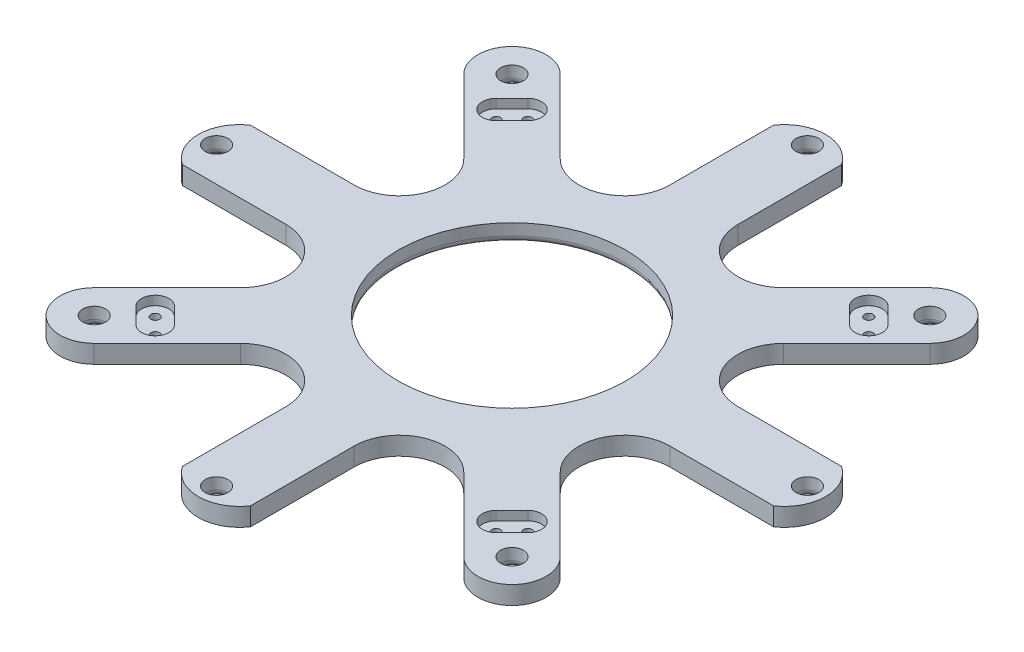
from build123d import *

# Parameters (mm, degrees)
SKETCH_1_R          = 5
EXTRUDE_1_DEPTH     = 8
SKETCH_2_R          = 5
EXTRUDE_2_DEPTH     = 8
SKETCH_3_R          = 5
EXTRUDE_3_DEPTH     = 8
SKETCH_4_R          = 5
EXTRUDE_4_DEPTH     = 8
FILLET_2_R          = 20
SKETCH_5_R          = 1.9
SKETCH_5_R_2        = 50
CUT_EXTRUDE_1_DEPTH = 10
CUT_EXTRUDE_2_DEPTH = 4
FILLET_3_R          = 3


with BuildPart() as part:
    # Эскиз1 → Бобышка-Вытянуть1 (new body)
    with BuildSketch(Plane(origin=(0, 0, 0), x_dir=(1, 0, 0), z_dir=(0, 1, 0))):
        with BuildLine():
            Line((-130, 15), (130, 15))
            ThreePointArc((130, 15), (138.027756377, 0), (130, -15))
            Line((130, -15), (-130, -15))
            ThreePointArc((-130, -15), (-138.027756377, 0), (-130, 15))
        make_face()
        with Locations(Location((130, 0, 0), (0, 0, 270))):
            Circle(SKETCH_1_R, mode=Mode.SUBTRACT)
        with Locations(Location((-130, 0, 0), (0, 0, 90))):
            Circle(SKETCH_1_R, mode=Mode.SUBTRACT)
    extrude(amount=EXTRUDE_1_DEPTH)

    # Эскиз2 → Бобышка-Вытянуть2 (add)
    with BuildSketch(Plane(origin=(0, 0, 0), x_dir=(1, 0, 0), z_dir=(0, 1, 0))):
        with BuildLine():
            Line((-15, 130), (-15, -130))
            ThreePointArc((-15, -130), (0, -138.027756377), (15, -130))
            Line((15, -130), (15, 130))
            ThreePointArc((15, 130), (0, 138.027756377), (-15, 130))
        make_face()
        with Locations(Location((0, 130, 0), (0, 0, 270))):
            Circle(SKETCH_2_R, mode=Mode.SUBTRACT)
        with Locations(Location((0, -130, 0), (0, 0, 90))):
            Circle(SKETCH_2_R, mode=Mode.SUBTRACT)
    extrude(amount=EXTRUDE_2_DEPTH)

    # Эскиз3 → Бобышка-Вытянуть3 (add)
    with BuildSketch(Plane(origin=(0, 0, 0), x_dir=(1, 0, 0), z_dir=(0, 1, 0))):
        with BuildLine():
            Line((102.530483272, 81.317279836), (-81.317279836, -102.530483272))
            ThreePointArc((-81.317279836, -102.530483272), (-102.530483272, -102.530483272), (-102.530483272, -81.317279836))
            Line((-102.530483272, -81.317279836), (81.317279836, 102.530483272))
            ThreePointArc((81.317279836, 102.530483272), (102.530483272, 102.530483272), (102.530483272, 81.317279836))
        make_face()
        with Locations(Location((91.923881554, 91.923881554, 0), (0, 0, 270))):
            Circle(SKETCH_3_R, mode=Mode.SUBTRACT)
        with Locations(Location((-91.923881554, -91.923881554, 0), (0, 0, 270))):
            Circle(SKETCH_3_R, mode=Mode.SUBTRACT)
    extrude(amount=EXTRUDE_3_DEPTH)

    # Эскиз4 → Бобышка-Вытянуть4 (add)
    with BuildSketch(Plane(origin=(0, 0, 0), x_dir=(1, 0, 0), z_dir=(0, 1, 0))):
        with BuildLine():
            Line((-81.317279836, 102.530483272), (102.530483272, -81.317279836))
            ThreePointArc((102.530483272, -81.317279836), (102.530483272, -102.530483272), (81.317279836, -102.530483272))
            Line((81.317279836, -102.530483272), (-102.530483272, 81.317279836))
            ThreePointArc((-102.530483272, 81.317279836), (-102.530483272, 102.530483272), (-81.317279836, 102.530483272))
        make_face()
        with Locations(Location((-91.923881554, 91.923881554, 0), (0, 0, 270))):
            Circle(SKETCH_4_R, mode=Mode.SUBTRACT)
        with Locations(Location((91.923881554, -91.923881554, 0), (0, 0, 270))):
            Circle(SKETCH_4_R, mode=Mode.SUBTRACT)
    extrude(amount=EXTRUDE_4_DEPTH)

    # Скругление2
    fillet_2_edges = [part.edges().sort_by_distance(p)[0] for p in [
        (15, 4, -36.213203436),
        (-15, 4, 36.213203436),
        (36.213203436, 4, -15),
        (-36.213203436, 4, 15),
        (-15, 4, -36.213203436),
        (15, 4, 36.213203436),
        (-36.213203436, 4, -15),
        (36.213203436, 4, 15),
    ]]
    fillet(fillet_2_edges, radius=FILLET_2_R)

    # Эскиз5 → Вырез-Вытянуть1 (cut)
    with BuildSketch(Plane(origin=(0, 0, 0), x_dir=(1, 0, 0), z_dir=(0, 1, 0))):
        with Locations(Location((75, 82, 0), (0, 0, 90))):
            Circle(SKETCH_5_R)
        with Locations(Location((82, 75, 0), (0, 0, 90))):
            Circle(SKETCH_5_R)
        with Locations(Location((-82, 75, 0), (0, 0, 90))):
            Circle(SKETCH_5_R)
        with Locations(Location((-75, 82, 0), (0, 0, 90))):
            Circle(SKETCH_5_R)
        with Locations(Location((-75, -82, 0), (0, 0, 90))):
            Circle(SKETCH_5_R)
        with Locations(Location((-82, -75, 0), (0, 0, 90))):
            Circle(SKETCH_5_R)
        with Locations(Location((82, -75, 0), (0, 0, 90))):
            Circle(SKETCH_5_R)
        with Locations(Location((75, -82, 0), (0, 0, 90))):
            Circle(SKETCH_5_R)
        with Locations(Location((0, 0, 0), (0, 0, 90))):
            Circle(SKETCH_5_R_2)
    extrude(amount=CUT_EXTRUDE_1_DEPTH, mode=Mode.SUBTRACT)

    # Эскиз6 → Вырез-Вытянуть2 (cut)
    with BuildSketch(Plane(origin=(0, 8, 0), x_dir=(1, 0, 0), z_dir=(0, 1, 0))):
        with BuildLine():
            Line((-86.242640687, 79.242640687), (-79.242640687, 86.242640687))
            ThreePointArc((-79.242640687, 86.242640687), (-70.757359313, 86.242640687), (-70.757359313, 77.757359313))
            Line((-70.757359313, 77.757359313), (-77.757359313, 70.757359313))
            ThreePointArc((-77.757359313, 70.757359313), (-86.242640687, 70.757359313), (-86.242640687, 79.242640687))
        make_face()
        with BuildLine():
            Line((79.242640687, 86.242640687), (86.242640687, 79.242640687))
            ThreePointArc((86.242640687, 79.242640687), (86.242640687, 70.757359313), (77.757359313, 70.757359313))
            Line((77.757359313, 70.757359313), (70.757359313, 77.757359313))
            ThreePointArc((70.757359313, 77.757359313), (70.757359313, 86.242640687), (79.242640687, 86.242640687))
        make_face()
        with BuildLine():
            Line((70.757359313, -77.757359313), (77.757359313, -70.757359313))
            ThreePointArc((77.757359313, -70.757359313), (86.242640687, -70.757359313), (86.242640687, -79.242640687))
            Line((86.242640687, -79.242640687), (79.242640687, -86.242640687))
            ThreePointArc((79.242640687, -86.242640687), (70.757359313, -86.242640687), (70.757359313, -77.757359313))
        make_face()
        with BuildLine():
            Line((-77.757359313, -70.757359313), (-70.757359313, -77.757359313))
            ThreePointArc((-70.757359313, -77.757359313), (-70.757359313, -86.242640687), (-79.242640687, -86.242640687))
            Line((-79.242640687, -86.242640687), (-86.242640687, -79.242640687))
            ThreePointArc((-86.242640687, -79.242640687), (-86.242640687, -70.757359313), (-77.757359313, -70.757359313))
        make_face()
    extrude(amount=-CUT_EXTRUDE_2_DEPTH, mode=Mode.SUBTRACT)

    # Скругление3
    fillet_3_edges = [part.edges().sort_by_distance(p)[0] for p in [
        (-130, 0, 5),
        (130, 0, -5),
        (0, 0, 50),
        (0, 0, -135),
        (0, 0, 135),
        (-91.923881554, 0, 86.923881554),
        (91.923881554, 0, -96.923881554),
        (91.923881554, 0, 86.923881554),
        (-91.923881554, 0, -96.923881554),
    ]]
    fillet(fillet_3_edges, radius=FILLET_3_R)


solid = part.part
